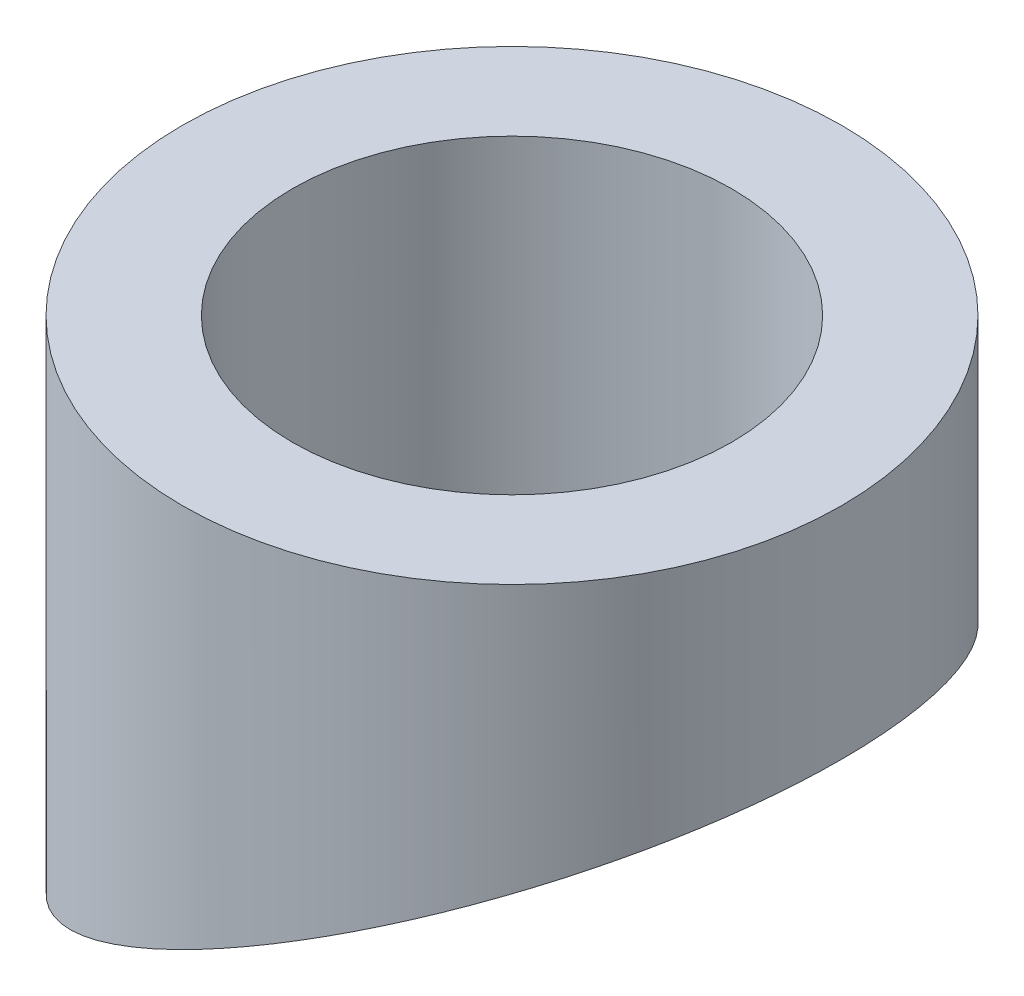
from build123d import *

# Parameters (mm, degrees)
SKETCH1_R           = 9
SKETCH1_R_2         = 6
BOSS_EXTRUDE1_DEPTH = 15
CUT_EXTRUDE1_DEPTH  = 15


with BuildPart() as part:
    # Sketch1 → Boss-Extrude1 (new body)
    with BuildSketch(Plane(origin=(0, 0, 0), x_dir=(1, 0, 0), z_dir=(0, 1, 0))):
        with Locations(Location((0, 0, 0), (0, 0, 270))):
            Circle(SKETCH1_R)
        with Locations(Location((0, 0, 0), (0, 0, 270))):
            Circle(SKETCH1_R_2, mode=Mode.SUBTRACT)
    extrude(amount=BOSS_EXTRUDE1_DEPTH)

    # Sketch3 → Cut-Extrude1 (cut, symmetric)
    with BuildSketch(Plane.XY):
        Polygon((-9, 0), (9, 9), (9, 0), align=None)
    extrude(amount=CUT_EXTRUDE1_DEPTH, both=True, mode=Mode.SUBTRACT)


solid = part.part
